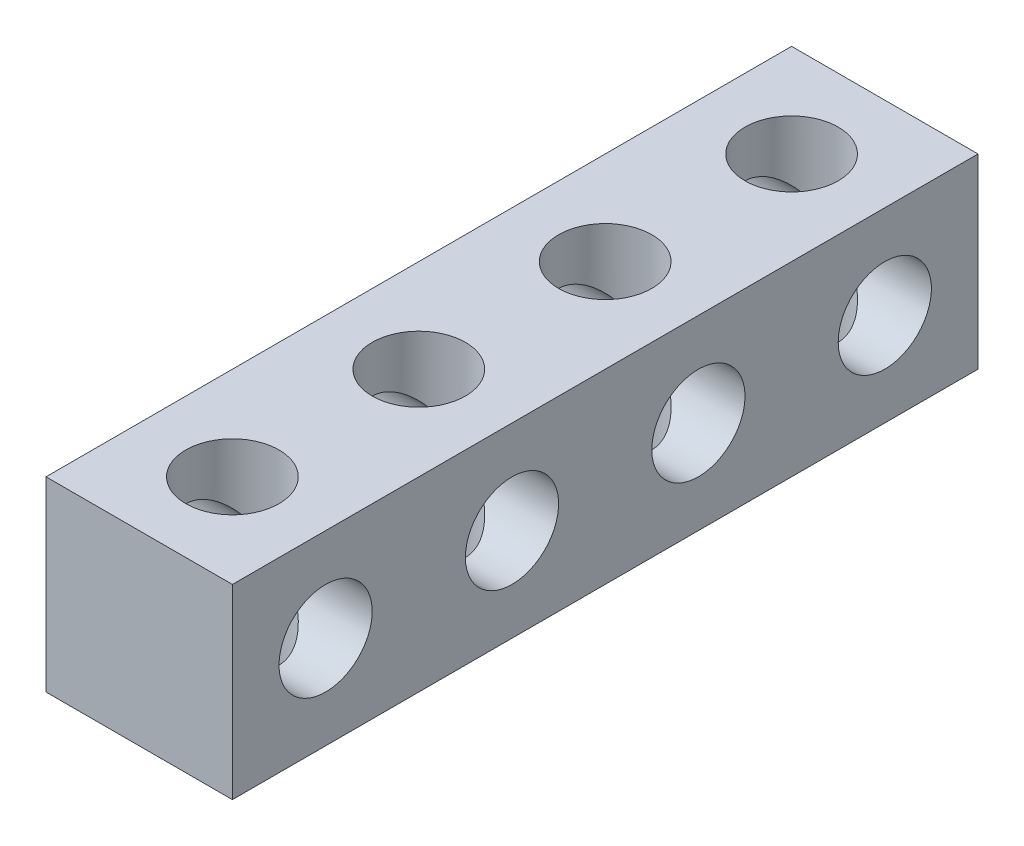
from build123d import *

# Parameters (mm, degrees)
SKETCH1_W           = 12.7
SKETCH1_H           = 12.7
BOSS_EXTRUDE1_DEPTH = 25.4
SKETCH2_R           = 3.175
CUT_EXTRUDE1_DEPTH  = 30.099355663
SKETCH4_R           = 3.175
CUT_EXTRUDE2_DEPTH  = 30.099355663


with BuildPart() as part:
    # Sketch1 → Boss-Extrude1 (new, symmetric)
    with BuildSketch(Plane.XY):
        Rectangle(SKETCH1_W, SKETCH1_H)
    extrude(amount=BOSS_EXTRUDE1_DEPTH, both=True)

    # Sketch2 → Cut-Extrude1 (cut, through all)
    with BuildSketch(Plane(origin=(0, 6.35, 0), x_dir=(1, 0, 0), z_dir=(0, 1, 0))):
        with Locations(Location((0, 19.05, 0), (0, 0, 270))):
            Circle(SKETCH2_R)
        with Locations(Location((0, 6.35, 0), (0, 0, 270))):
            Circle(SKETCH2_R)
        with Locations(Location((0, -6.35, 0), (0, 0, 270))):
            Circle(SKETCH2_R)
        with Locations(Location((0, -19.05, 0), (0, 0, 270))):
            Circle(SKETCH2_R)
        with Locations((0, -31.75)):
            Circle(SKETCH2_R)
        with Locations((0, -44.45)):
            Circle(SKETCH2_R)
    extrude(amount=-CUT_EXTRUDE1_DEPTH, mode=Mode.SUBTRACT)

    # Sketch4 → Cut-Extrude2 (cut, through all)
    with BuildSketch(Plane.ZY.offset(6.35)):
        with Locations((19.05, 0)):
            Circle(SKETCH4_R)
        with Locations((6.35, 0)):
            Circle(SKETCH4_R)
        with Locations((-6.35, 0)):
            Circle(SKETCH4_R)
        with Locations((-19.05, 0)):
            Circle(SKETCH4_R)
        with Locations((-31.75, 0)):
            Circle(SKETCH4_R)
        with Locations((-44.45, 0)):
            Circle(SKETCH4_R)
    extrude(amount=-CUT_EXTRUDE2_DEPTH, mode=Mode.SUBTRACT)


solid = part.part
